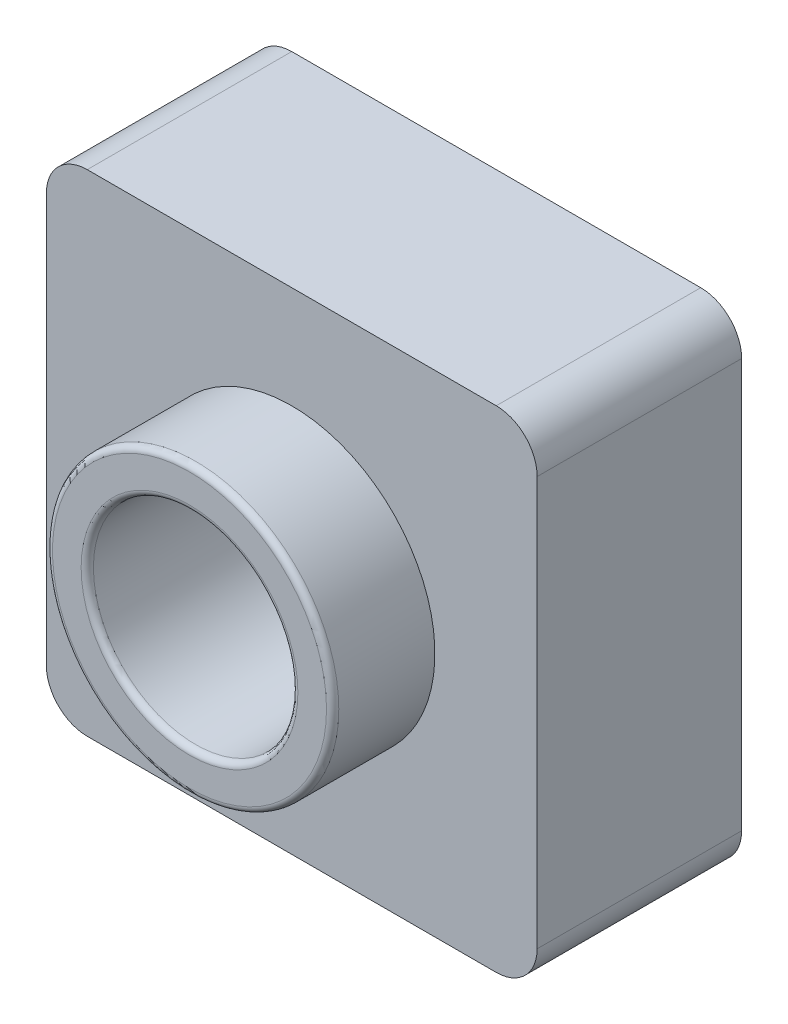
from build123d import *

# Parameters (mm, degrees)
SKETCH1_W           = 120
SKETCH1_H           = 120
BOSS_EXTRUDE1_DEPTH = 50
SKETCH2_R           = 35
BOSS_EXTRUDE2_DEPTH = 25
SKETCH3_R           = 25
CUT_EXTRUDE1_DEPTH  = 186.539753153
FILLET1_R           = 10
FILLET2_R           = 1.5
SHELL1_T            = -2


with BuildPart() as part:
    # Sketch1 → Boss-Extrude1 (new body)
    with BuildSketch(Plane.XY):
        with Locations((60, 60)):
            Rectangle(SKETCH1_W, SKETCH1_H)
    extrude(amount=BOSS_EXTRUDE1_DEPTH)

    # Sketch2 → Boss-Extrude2 (add)
    with BuildSketch(Plane.XY.offset(50)):
        with Locations(Location((60, 60, 0), (0, 0, 180))):
            Circle(SKETCH2_R)
    extrude(amount=BOSS_EXTRUDE2_DEPTH)

    # Sketch3 → Cut-Extrude1 (cut, through all)
    with BuildSketch(Plane.XY.offset(75)):
        with Locations((60, 60)):
            Circle(SKETCH3_R)
    extrude(amount=-CUT_EXTRUDE1_DEPTH, mode=Mode.SUBTRACT)

    # Fillet1
    fillet1_edges = [part.edges().sort_by_distance(p)[0] for p in [
        (0, 120, 25),
        (120, 120, 25),
        (120, 0, 25),
        (0, 0, 25),
    ]]
    fillet(fillet1_edges, radius=FILLET1_R)

    # Fillet2
    fillet2_edges = [part.edges().sort_by_distance(p)[0] for p in [
        (95, 60, 75),
        (35, 60, 75),
    ]]
    fillet(fillet2_edges, radius=FILLET2_R)

    # Shell1
    shell1_openings = [part.faces().sort_by_distance(p)[0] for p in [
        (60, 1.697056275, 0),
    ]]
    offset(amount=SHELL1_T, openings=shell1_openings, kind=Kind.INTERSECTION)


solid = part.part
